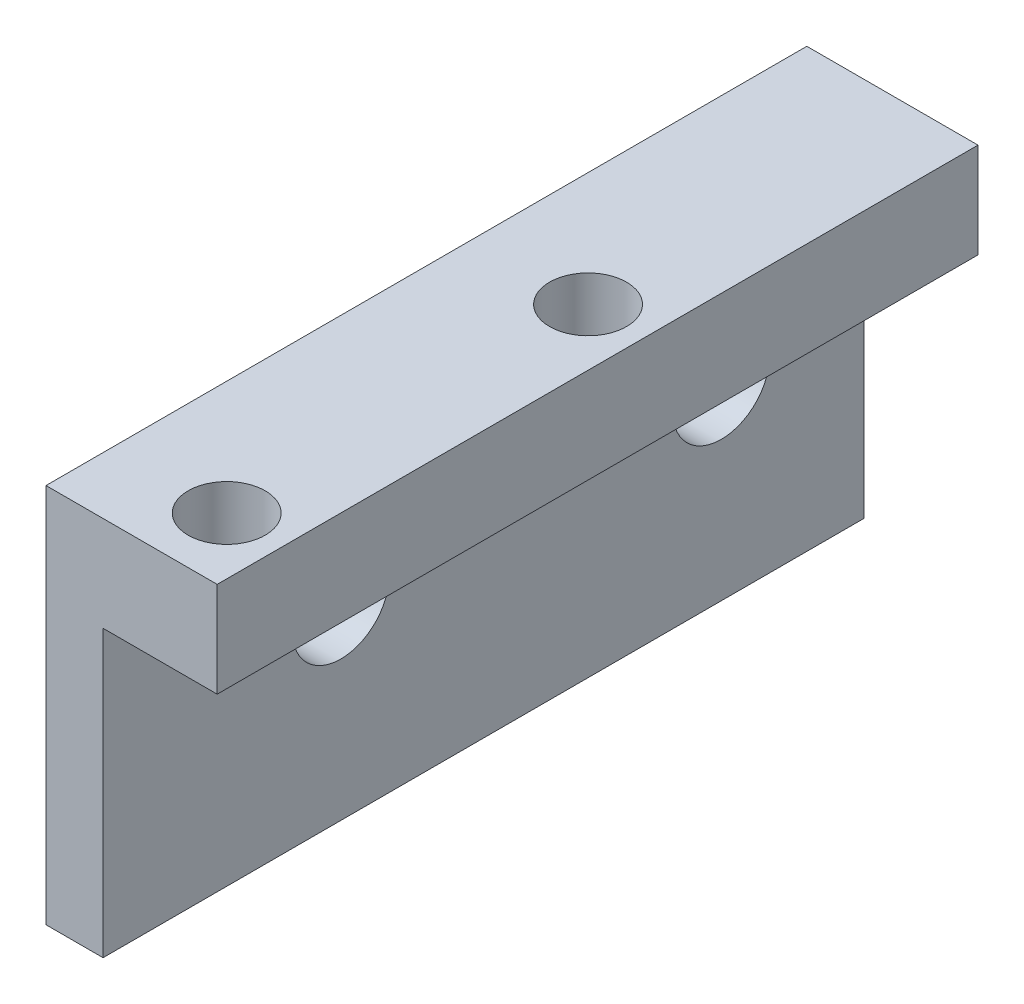
from build123d import *

# Parameters (mm, degrees)
SKETCH1_W           = 9
SKETCH1_H           = 40
SKETCH1_R           = 2.025
BOSS_EXTRUDE1_DEPTH = 5
SKETCH2_W           = 3
SKETCH2_H           = 40
BOSS_EXTRUDE2_DEPTH = 15
SKETCH3_R           = 2.55
CUT_EXTRUDE1_DEPTH  = 46.122056691


with BuildPart() as part:
    # Sketch1 → Boss-Extrude1 (new body)
    with BuildSketch(Plane(origin=(0, 0, 0), x_dir=(1, 0, 0), z_dir=(0, 1, 0))):
        with Locations((4.5, 20)):
            Rectangle(SKETCH1_W, SKETCH1_H)
        with Locations(Location((6, 3.499356869, 0), (0, 0, 270))):
            Circle(SKETCH1_R, mode=Mode.SUBTRACT)
        with Locations(Location((6, 22.499356869, 0), (0, 0, 270))):
            Circle(SKETCH1_R, mode=Mode.SUBTRACT)
    extrude(amount=-BOSS_EXTRUDE1_DEPTH)

    # Sketch2 → Boss-Extrude2 (add)
    with BuildSketch(Plane.XZ.offset(5)):
        with Locations((1.5, -20)):
            Rectangle(SKETCH2_W, SKETCH2_H)
    extrude(amount=BOSS_EXTRUDE2_DEPTH)

    # Sketch3 → Cut-Extrude1 (cut, through all)
    with BuildSketch(Plane(origin=(3, 0, 0), x_dir=(0, 0, -1), z_dir=(1, 0, 0))):
        with Locations((12.5, -10.1)):
            Circle(SKETCH3_R)
        with Locations((32.5, -10.1)):
            Circle(SKETCH3_R)
    extrude(amount=-CUT_EXTRUDE1_DEPTH, mode=Mode.SUBTRACT)


solid = part.part
